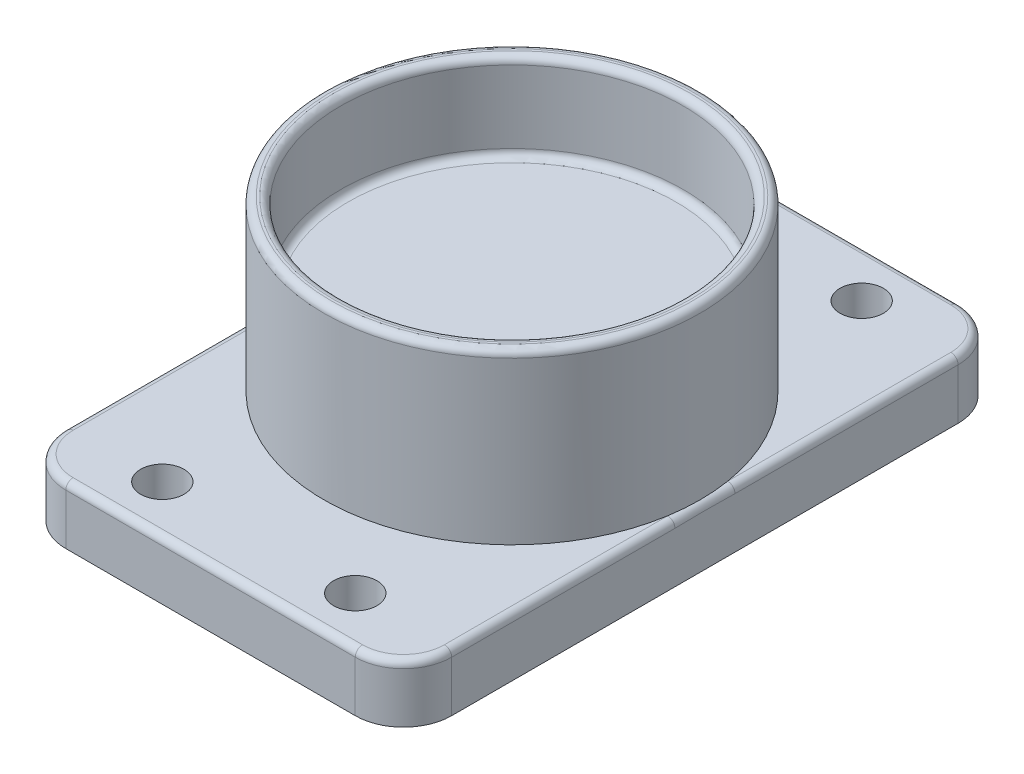
from build123d import *

# Parameters (mm, degrees)
SZKIC1_W                    = 80
SZKIC1_H                    = 125
DODANIE_WYCI_GNI_CIE1_DEPTH = 12
SZKIC2_R                    = 39
SZKIC2_R_2                  = 35.5
DODANIE_WYCI_GNI_CIE2_DEPTH = 35
SZKIC4_R                    = 35.5
DODANIE_WYCI_GNI_CIE3_DEPTH = 17
ZAOKR_GLENIE1_R             = 10
ZAOKR_GLENIE2_R             = 1.5


with BuildPart() as part:
    # Szkic1 → Dodanie-wyciągnięcie1 (new body)
    with BuildSketch(Plane(origin=(0, 0, 0), x_dir=(1, 0, 0), z_dir=(0, 1, 0))):
        Rectangle(SZKIC1_W, SZKIC1_H)
    extrude(amount=DODANIE_WYCI_GNI_CIE1_DEPTH)

    # Szkic2 → Dodanie-wyciągnięcie2 (add)
    with BuildSketch(Plane(origin=(0, 12, 0), x_dir=(1, 0, 0), z_dir=(0, 1, 0))):
        with Locations(Location((0, 0, 0), (0, 0, 270))):
            Circle(SZKIC2_R)
        with Locations(Location((0, 0, 0), (0, 0, 270))):
            Circle(SZKIC2_R_2, mode=Mode.SUBTRACT)
    extrude(amount=DODANIE_WYCI_GNI_CIE2_DEPTH)

    # Szkic4 → Dodanie-wyciągnięcie3 (add)
    with BuildSketch(Plane(origin=(0, 12, 0), x_dir=(1, 0, 0), z_dir=(0, 1, 0))):
        with Locations(Location((0, 0, 0), (0, 0, 270))):
            Circle(SZKIC4_R)
    extrude(amount=DODANIE_WYCI_GNI_CIE3_DEPTH)

    # Zaokrąglenie1
    zaokr_glenie1_edges = [part.edges().sort_by_distance(p)[0] for p in [
        (-40, 6, -62.5),
        (40, 6, -62.5),
        (40, 6, 62.5),
        (-40, 6, 62.5),
    ]]
    fillet(zaokr_glenie1_edges, radius=ZAOKR_GLENIE1_R)

    # Zaokrąglenie2
    zaokr_glenie2_edges = [part.edges().sort_by_distance(p)[0] for p in [
        (0, 47, -39),
        (0, 47, -35.5),
        (0, 29, -35.5),
        (0, 12, -62.5),
        (40, 12, 0),
        (-40, 12, 0),
        (0, 12, 62.5),
        (37.071067812, 12, 59.571067812),
        (-37.071067812, 12, 59.571067812),
        (-37.071067812, 12, -59.571067812),
        (37.071067812, 12, -59.571067812),
    ]]
    fillet(zaokr_glenie2_edges, radius=ZAOKR_GLENIE2_R)

    # Szkic9 → Otwór pod śrubę M82 (revolve, cut)
    with BuildSketch(Plane(origin=(-20, 12, 52.5), x_dir=(0, 0, 1), z_dir=(1, 0, 0))):
        Polygon((0, 0), (0, 18.703872786), (4.5, 16), (4.5, 0), align=None)
    otw_r_pod_rub_m82 = revolve(axis=Axis((-20, 18.35, 52.5), (0, -1, 0)), mode=Mode.SUBTRACT)

    # Lustro3: Otwór pod śrubę M82 across plane
    add(otw_r_pod_rub_m82.mirror(Plane(origin=(0, 0, 0), x_dir=(0, 0, 1), z_dir=(1, 0, 0))), mode=Mode.SUBTRACT)

    # Lustro4: Otwór pod śrubę M82 across plane
    add(otw_r_pod_rub_m82.mirror(Plane.XY), mode=Mode.SUBTRACT)

    # Lustro4 copy 1 sketch → Lustro4 copy 1 (revolve, cut)
    with BuildSketch(Plane(origin=(20, 12, -52.5), x_dir=(0, 0, -1), z_dir=(-1, 0, 0))):
        Polygon((0, 0), (0, 18.703872786), (4.5, 16), (4.5, 0), align=None)
    revolve(axis=Axis((20, 18.35, -52.5), (0, -1, 0)), mode=Mode.SUBTRACT)


solid = part.part
